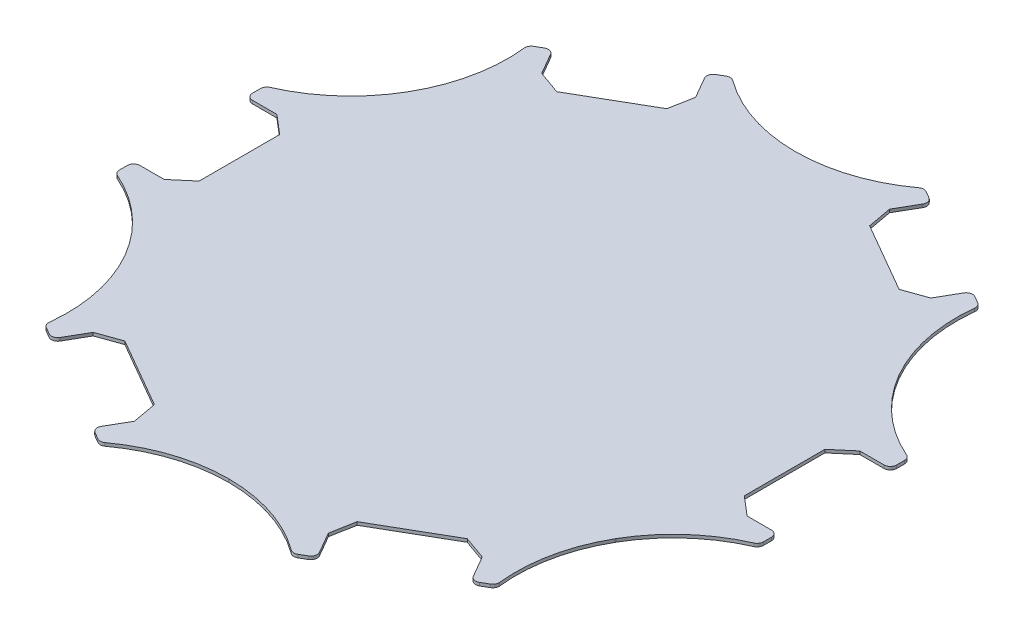
from build123d import *

# Parameters (mm, degrees)
SKETCH2_R           = 1.35
BOSS_EXTRUDE1_DEPTH = 1
CIRPATTERN1_COUNT   = 6
CUT_EXTRUDE3_DEPTH  = 5
CUT_EXTRUDE9_DEPTH  = 10
CUT_EXTRUDE10_DEPTH = 186.676097905
FILLET2_R           = 2


with BuildPart() as part:
    # Sketch2 → Boss-Extrude1 (new body)
    with BuildSketch(Plane(origin=(0, 0, 0), x_dir=(1, 0, 0), z_dir=(0, 1, 0))):
        Polygon((0, 125), (-58.08143708, 125), (-35.58143708, 86.02885683), (-56.712456933, 73.82885683), (-79.212456933, 112.8), (-108.253175473, 62.5), (0, 0), align=None)
        with Locations(Location((-37.385731074, 81.753985699, 0), (0, 0, 270))):
            Circle(SKETCH2_R, mode=Mode.SUBTRACT)
        with Locations(Location((-52.108162939, 73.253985699, 0), (0, 0, 270))):
            Circle(SKETCH2_R, mode=Mode.SUBTRACT)
        with Locations(Location((-60.887328063, 75.459945743, 0), (0, 0, 270))):
            Circle(SKETCH2_R, mode=Mode.SUBTRACT)
        with Locations(Location((-34.90656595, 90.459945743, 0), (0, 0, 270))):
            Circle(SKETCH2_R, mode=Mode.SUBTRACT)
        with Locations(Location((-51.90656595, 119.904809472, 0), (0, 0, 270))):
            Circle(SKETCH2_R, mode=Mode.SUBTRACT)
        with Locations(Location((-43.40656595, 105.182377607, 0), (0, 0, 270))):
            Circle(SKETCH2_R, mode=Mode.SUBTRACT)
        with Locations(Location((-69.387328063, 90.182377607, 0), (0, 0, 270))):
            Circle(SKETCH2_R, mode=Mode.SUBTRACT)
        with Locations(Location((-77.887328063, 104.904809472, 0), (0, 0, 270))):
            Circle(SKETCH2_R, mode=Mode.SUBTRACT)
    boss_extrude1 = extrude(amount=BOSS_EXTRUDE1_DEPTH)

    # CirPattern1: Boss-Extrude1 ×6 about axis
    cirpattern1_axis = Axis((0, 0, 0), (0, 1, 0))
    for i in range(1, CIRPATTERN1_COUNT):
        add(boss_extrude1.rotate(cirpattern1_axis, i * 360 / CIRPATTERN1_COUNT))

    # Sketch4 → Cut-Extrude3 (cut)
    with BuildSketch(Plane(origin=(0, 1, 0), x_dir=(1, 0, 0), z_dir=(0, 1, 0))):
        with BuildLine():
            Line((79.212456933, -112.8), (137.293894013, -12.2))
            ThreePointArc((137.293894013, -12.2), (125.5592118, -23.716902798), (109.56410095, -27.524558982))
            ThreePointArc((109.56410095, -27.524558982), (77.942286341, -45), (78.619017782, -81.123015275))
            ThreePointArc((78.619017782, -81.123015275), (83.319046223, -96.879015699), (79.212456933, -112.8))
        make_face()
        with BuildLine():
            Line((137.293894013, 12.2), (79.212456933, 112.8))
            ThreePointArc((79.212456933, 112.8), (83.319046223, 96.879015699), (78.619017782, 81.123015275))
            ThreePointArc((78.619017782, 81.123015275), (77.942286341, 45), (109.56410095, 27.524558982))
            ThreePointArc((109.56410095, 27.524558982), (125.5592118, 23.716902798), (137.293894013, 12.2))
        make_face()
        with BuildLine():
            Line((58.08143708, 125), (-58.08143708, 125))
            ThreePointArc((-58.08143708, 125), (-42.240165578, 120.595918497), (-30.945083169, 108.647574257))
            ThreePointArc((-30.945083169, 108.647574257), (0, 90), (30.945083169, 108.647574257))
            ThreePointArc((30.945083169, 108.647574257), (42.240165578, 120.595918497), (58.08143708, 125))
        make_face()
        with BuildLine():
            Line((-79.212456933, 112.8), (-137.293894013, 12.2))
            ThreePointArc((-137.293894013, 12.2), (-125.5592118, 23.716902798), (-109.56410095, 27.524558982))
            ThreePointArc((-109.56410095, 27.524558982), (-77.942286341, 45), (-78.619017782, 81.123015275))
            ThreePointArc((-78.619017782, 81.123015275), (-83.319046223, 96.879015699), (-79.212456933, 112.8))
        make_face()
        with BuildLine():
            Line((-137.293894013, -12.2), (-79.212456933, -112.8))
            ThreePointArc((-79.212456933, -112.8), (-83.319046223, -96.879015699), (-78.619017782, -81.123015275))
            ThreePointArc((-78.619017782, -81.123015275), (-77.942286341, -45), (-109.56410095, -27.524558982))
            ThreePointArc((-109.56410095, -27.524558982), (-125.5592118, -23.716902798), (-137.293894013, -12.2))
        make_face()
        with BuildLine():
            Line((-58.08143708, -125), (58.08143708, -125))
            ThreePointArc((58.08143708, -125), (42.240165578, -120.595918497), (30.945083169, -108.647574257))
            ThreePointArc((30.945083169, -108.647574257), (0, -90), (-30.945083169, -108.647574257))
            ThreePointArc((-30.945083169, -108.647574257), (-42.240165578, -120.595918497), (-58.08143708, -125))
        make_face()
    extrude(amount=-CUT_EXTRUDE3_DEPTH, mode=Mode.SUBTRACT)

    # Sketch8 → Cut-Extrude9 (cut)
    with BuildSketch(Plane(origin=(0, 1, 0), x_dir=(1, 0, 0), z_dir=(0, 1, 0))):
        with BuildLine():
            Line((-79.627397697, 112.081427342), (-137.090413308, 12.563994028))
            ThreePointArc((-137.090413308, 12.563994028), (-131.312677504, 18.215244412), (-123.44128918, 20.048304088))
            ThreePointArc((-123.44128918, 20.048304088), (-77.942300503, 45.000018775), (-79.083064161, 96.879154221))
            ThreePointArc((-79.083064161, 96.879154221), (-81.425302856, 104.406169658), (-79.627397697, 112.081427342))
        make_face()
        with BuildLine():
            Line((-136.879097611, -12.918653567), (-79.425980046, -112.441801521))
            ThreePointArc((-79.425980046, -112.441801521), (-81.43123854, -104.612510346), (-79.083020624, -96.879158257))
            ThreePointArc((-79.083020624, -96.879158257), (-77.942345072, -45.000020873), (-123.441376125, -20.048383457))
            ThreePointArc((-123.441376125, -20.048383457), (-131.131082054, -18.31331395), (-136.879097611, -12.918653567))
        make_face()
        with BuildLine():
            Line((-57.251702025, -125.000120556), (57.66443115, -125.005835196))
            ThreePointArc((57.66443115, -125.005835196), (49.881436852, -122.827794405), (44.358266444, -116.927501992))
            ThreePointArc((44.358266444, -116.927501992), (-4.6681e-05, -90.000079294), (-44.358314075, -116.927577326))
            ThreePointArc((-44.358314075, -116.927577326), (-49.70578131, -122.719523255), (-57.251702025, -125.000120556))
        make_face()
        with BuildLine():
            Line((79.627393474, -112.081506636), (137.090409084, -12.564073322))
            ThreePointArc((137.090409084, -12.564073322), (131.312673281, -18.215323706), (123.441284957, -20.048383382))
            ThreePointArc((123.441284957, -20.048383382), (77.94229628, -45.000098069), (79.083059938, -96.879233516))
            ThreePointArc((79.083059938, -96.879233516), (81.425298632, -104.406248952), (79.627393474, -112.081506636))
        make_face()
        with BuildLine():
            Line((136.879093387, 12.918574273), (79.425975823, 112.441722226))
            ThreePointArc((79.425975823, 112.441722226), (81.431234317, 104.612431052), (79.083016401, 96.879078963))
            ThreePointArc((79.083016401, 96.879078963), (77.942340849, 44.999941578), (123.441371902, 20.048304163))
            ThreePointArc((123.441371902, 20.048304163), (131.131077831, 18.313234656), (136.879093387, 12.918574273))
        make_face()
        with BuildLine():
            Line((57.251697801, 125.000041262), (-57.664435373, 125.005755901))
            ThreePointArc((-57.664435373, 125.005755901), (-49.881441076, 122.827715111), (-44.358270668, 116.927422698))
            ThreePointArc((-44.358270668, 116.927422698), (4.2458e-05, 90), (44.358309852, 116.927498031))
            ThreePointArc((44.358309852, 116.927498031), (49.705777087, 122.71944396), (57.251697801, 125.000041262))
        make_face()
    extrude(amount=-CUT_EXTRUDE9_DEPTH, mode=Mode.SUBTRACT)

    # Sketch9 → Cut-Extrude10 (cut, through all)
    with BuildSketch(Plane(origin=(0, 1, 0), x_dir=(1, 0, 0), z_dir=(0, 1, 0))):
        Polygon((86.593894013, 12.8), (92.594856816, 17.9), (102.293894013, 17.9), (102.293894013, 27.495537581), (142.49088479, 27.495537581), (142.49088479, -27.407665194), (102.293894013, -27.407665194), (102.293894013, -17.9), (92.594856816, -17.9), (86.593894013, -12.8), align=None)
        Polygon((95.057276431, -109.652957246), (47.509708079, -137.104558633), (27.41121269, -102.292943464), (35.645092279, -97.539110868), (30.79557368, -89.139498262), (32.211821838, -81.392512028), (54.382072175, -68.592512028), (61.799283136, -71.239498262), (66.648801734, -79.639110868), (74.958781042, -74.841342077), align=None)
        Polygon((-47.43360836, -137.148494826), (-94.981176711, -109.696893439), (-74.882681323, -74.885278271), (-66.648801734, -79.639110868), (-61.799283136, -71.239498262), (-54.382072175, -68.592512028), (-32.211821838, -81.392512028), (-30.79557368, -89.139498262), (-35.645092279, -97.539110868), (-27.335112971, -102.336879658), align=None)
        Polygon((-142.49088479, -27.495537581), (-142.49088479, 27.407665194), (-102.293894013, 27.407665194), (-102.293894013, 17.9), (-92.594856816, 17.9), (-86.593894013, 12.8), (-86.593894013, -12.8), (-92.594856816, -17.9), (-102.293894013, -17.9), (-102.293894013, -27.495537581), align=None)
        Polygon((-95.057276431, 109.652957246), (-47.509708079, 137.104558633), (-27.41121269, 102.292943464), (-35.645092279, 97.539110868), (-30.79557368, 89.139498262), (-32.211821838, 81.392512028), (-54.382072175, 68.592512028), (-61.799283136, 71.239498262), (-66.648801734, 79.639110868), (-74.958781042, 74.841342077), align=None)
        Polygon((47.43360836, 137.148494826), (94.981176711, 109.696893439), (74.882681323, 74.885278271), (66.648801734, 79.639110868), (61.799283136, 71.239498262), (54.382072175, 68.592512028), (32.211821838, 81.392512028), (30.79557368, 89.139498262), (35.645092279, 97.539110868), (27.335112971, 102.336879658), align=None)
    extrude(amount=-CUT_EXTRUDE10_DEPTH, mode=Mode.SUBTRACT)

    # Fillet2
    fillet2_edges = [part.edges().sort_by_distance(p)[0] for p in [
        (30.596139754, 0.5, -100.454124967),
        (-30.596139754, 0.5, -100.454124967),
        (71.697787846, 0.5, -76.724077377),
        (102.293894013, 0.5, -23.730020176),
        (102.293894013, 0.5, 23.730102263),
        (71.697775448, 0.5, 76.724084535),
        (30.596078644, 0.5, 100.454160249),
        (-30.596083481, 0.5, 100.454157456),
        (-71.697781783, 0.5, 76.724080878),
        (-102.293894013, 0.5, 23.7301012),
        (-71.697789343, 0.5, -76.724076512),
        (-102.293894013, 0.5, -23.730024698),
        (66.648801734, 0.5, 79.639110868),
        (35.645092279, 0.5, 97.539110868),
        (-35.645092279, 0.5, 97.539110868),
        (-66.648801734, 0.5, 79.639110868),
        (-102.293894013, 0.5, 17.9),
        (-102.293894013, 0.5, -17.9),
        (-66.648801734, 0.5, -79.639110868),
        (-35.645092279, 0.5, -97.539110868),
        (35.645092279, 0.5, -97.539110868),
        (66.648801734, 0.5, -79.639110868),
        (102.293894013, 0.5, -17.9),
        (102.293894013, 0.5, 17.9),
    ]]
    fillet(fillet2_edges, radius=FILLET2_R)


solid = part.part
